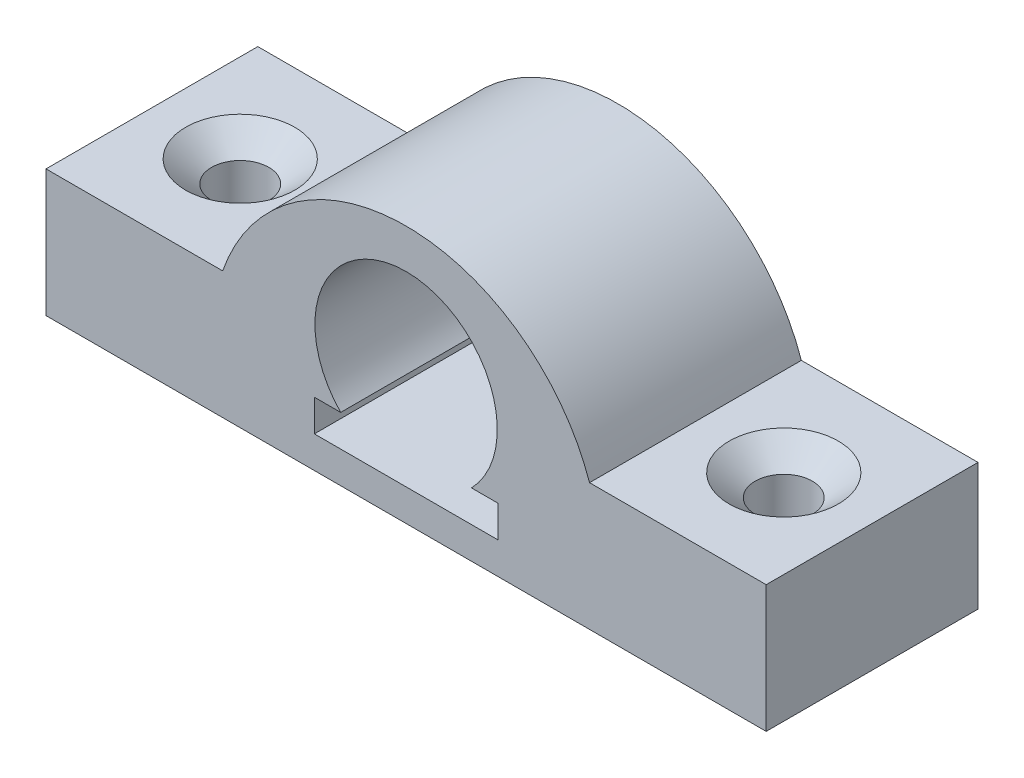
from build123d import *

# Parameters (mm, degrees)
SKETCH2_W                                           = 85
SKETCH2_H                                           = 25
BOSS_EXTRUDE1_DEPTH                                 = 15
BOSS_EXTRUDE3_DEPTH                                 = 25
CSK_FOR_1_4_FLAT_HEAD_MACHINE_SCREW_100_D           = 6.7564
CSK_FOR_1_4_FLAT_HEAD_MACHINE_SCREW_100_CSINK_D     = 12.8778
CSK_FOR_1_4_FLAT_HEAD_MACHINE_SCREW_100_CSINK_ANGLE = 100
CUT_EXTRUDE1_DEPTH                                  = 55


with BuildPart() as part:
    # Sketch2 → Boss-Extrude1 (new body)
    with BuildSketch(Plane(origin=(0, 0, 0), x_dir=(1, 0, 0), z_dir=(0, 1, 0))):
        with Locations((42.5, 12.5)):
            Rectangle(SKETCH2_W, SKETCH2_H)
    extrude(amount=BOSS_EXTRUDE1_DEPTH)

    # Sketch6 → Boss-Extrude3 (add)
    with BuildSketch(Plane.XY):
        with BuildLine():
            Line((20.849364905, 15), (64.150635095, 15))
            ThreePointArc((64.150635095, 15), (42.5, 30.412878475), (20.849364905, 15))
        make_face()
    extrude(amount=-BOSS_EXTRUDE3_DEPTH)

    # CSK for 1/4 Flat Head Machine Screw (100)1 (through all)
    with Locations(Plane(origin=(0, 15, 0), x_dir=(1, 0, 0), z_dir=(0, 1, 0))):
        with Locations((74.575317547, 12.5), (10.424682453, 12.5)):
            CounterSinkHole(CSK_FOR_1_4_FLAT_HEAD_MACHINE_SCREW_100_D / 2, CSK_FOR_1_4_FLAT_HEAD_MACHINE_SCREW_100_CSINK_D / 2, counter_sink_angle=CSK_FOR_1_4_FLAT_HEAD_MACHINE_SCREW_100_CSINK_ANGLE)

    # Sketch7 → Cut-Extrude1 (cut)
    with BuildSketch(Plane.XY):
        with BuildLine():
            Line((53.325317547, 3.75), (53.325317547, 7.5))
            Line((53.325317547, 7.5), (50.218877835, 7.5))
            ThreePointArc((50.218877835, 7.5), (42.5, 25.762484612), (34.781122165, 7.5))
            Line((34.781122165, 7.5), (31.674682453, 7.5))
            Line((31.674682453, 7.5), (31.674682453, 3.75))
            Line((31.674682453, 3.75), (53.325317547, 3.75))
        make_face()
    extrude(amount=-CUT_EXTRUDE1_DEPTH, mode=Mode.SUBTRACT)


solid = part.part
